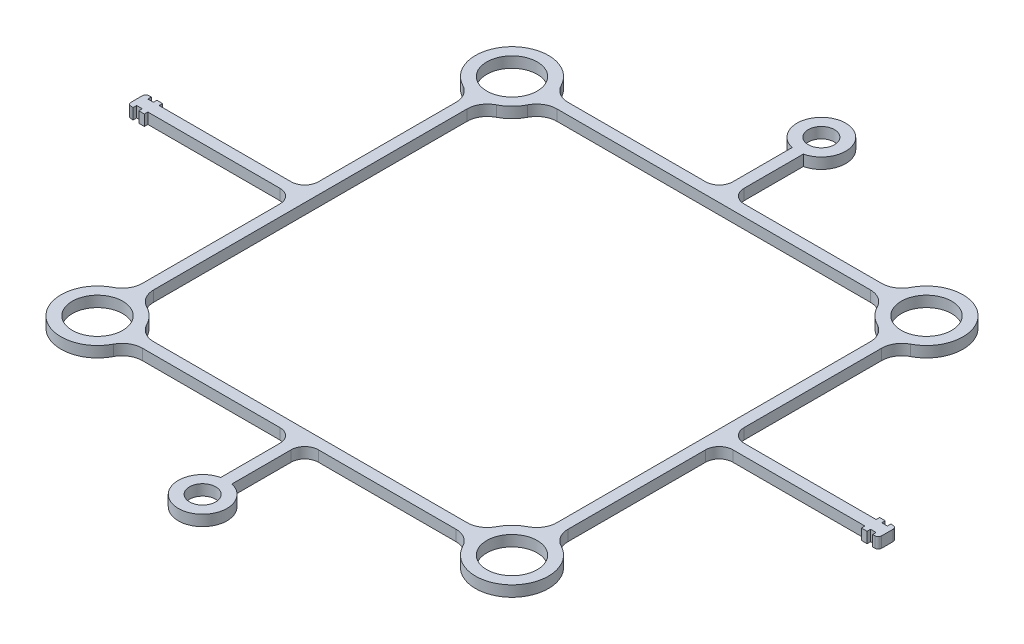
from build123d import *

# Parameters (mm, degrees)
SKETCH1_R           = 3.71
SKETCH1_R_2         = 1.925
BOSS_EXTRUDE1_DEPTH = 1.5875
FILLET1_R           = 3
FILLET2_R           = 2
FILLET3_R           = 0.5


with BuildPart() as part:
    # Sketch1 → Boss-Extrude1 (new body)
    with BuildSketch(Plane(origin=(0, 0, 0), x_dir=(1, 0, 0), z_dir=(0, 1, 0))):
        with BuildLine():
            Line((-25.148871697, 32.027846467), (-0.825, 32.027846467))
            Line((-0.825, 32.027846467), (-0.825, 42.724341041))
            ThreePointArc((-0.825, 42.724341041), (0, 49.777846467), (0.825, 42.724341041))
            Line((0.825, 42.724341041), (0.825, 32.027846467))
            Line((0.825, 32.027846467), (25.148871697, 32.027846467))
            ThreePointArc((25.148871697, 32.027846467), (34.235092347, 34.992938814), (31.27, 25.906718164))
            Line((31.27, 25.906718164), (31.27, 1.582846467))
            Line((31.27, 1.582846467), (52.669827862, 1.582846467))
            Line((52.669827862, 1.582846467), (52.669827862, 2.092846467))
            Line((52.669827862, 2.092846467), (53.494827862, 2.092846467))
            Line((53.494827862, 2.092846467), (53.494827862, 1.582846467))
            Line((53.494827862, 1.582846467), (54.319827862, 1.582846467))
            Line((54.319827862, 1.582846467), (54.319827862, 2.092846467))
            Line((54.319827862, 2.092846467), (55.144827862, 2.092846467))
            Line((55.144827862, 2.092846467), (55.144827862, -0.577153533))
            Line((55.144827862, -0.577153533), (54.319827862, -0.577153533))
            Line((54.319827862, -0.577153533), (54.319827862, -0.067153533))
            Line((54.319827862, -0.067153533), (53.494827862, -0.067153533))
            Line((53.494827862, -0.067153533), (53.494827862, -0.577153533))
            Line((53.494827862, -0.577153533), (52.669827862, -0.577153533))
            Line((52.669827862, -0.577153533), (52.669827862, -0.067153533))
            Line((52.669827862, -0.067153533), (31.27, -0.067153533))
            Line((31.27, -0.067153533), (31.27, -24.39102523))
            ThreePointArc((31.27, -24.39102523), (34.235092347, -33.47724588), (25.148871697, -30.512153533))
            Line((25.148871697, -30.512153533), (0.825, -30.512153533))
            Line((0.825, -30.512153533), (0.825, -41.208648107))
            ThreePointArc((0.825, -41.208648107), (0, -48.262153533), (-0.825, -41.208648107))
            Line((-0.825, -41.208648107), (-0.825, -30.512153533))
            Line((-0.825, -30.512153533), (-25.148871697, -30.512153533))
            ThreePointArc((-25.148871697, -30.512153533), (-34.235092347, -33.47724588), (-31.27, -24.39102523))
            Line((-31.27, -24.39102523), (-31.27, -0.067153533))
            Line((-31.27, -0.067153533), (-52.669827862, -0.067153533))
            Line((-52.669827862, -0.067153533), (-52.669827862, -0.577153533))
            Line((-52.669827862, -0.577153533), (-53.494827862, -0.577153533))
            Line((-53.494827862, -0.577153533), (-53.494827862, -0.067153533))
            Line((-53.494827862, -0.067153533), (-54.319827862, -0.067153533))
            Line((-54.319827862, -0.067153533), (-54.319827862, -0.577153533))
            Line((-54.319827862, -0.577153533), (-55.144827862, -0.577153533))
            Line((-55.144827862, -0.577153533), (-55.144827862, 2.092846467))
            Line((-55.144827862, 2.092846467), (-54.319827862, 2.092846467))
            Line((-54.319827862, 2.092846467), (-54.319827862, 1.582846467))
            Line((-54.319827862, 1.582846467), (-53.494827862, 1.582846467))
            Line((-53.494827862, 1.582846467), (-53.494827862, 2.092846467))
            Line((-53.494827862, 2.092846467), (-52.669827862, 2.092846467))
            Line((-52.669827862, 2.092846467), (-52.669827862, 1.582846467))
            Line((-52.669827862, 1.582846467), (-31.27, 1.582846467))
            Line((-31.27, 1.582846467), (-31.27, 25.906718164))
            ThreePointArc((-31.27, 25.906718164), (-34.235092347, 34.992938814), (-25.148871697, 32.027846467))
        make_face()
        with Locations(Location((-30.445, 31.202846467, 0), (0, 0, 270))):
            Circle(SKETCH1_R, mode=Mode.SUBTRACT)
        with Locations(Location((30.445, 31.202846467, 0), (0, 0, 90))):
            Circle(SKETCH1_R, mode=Mode.SUBTRACT)
        with Locations(Location((30.445, -29.687153533, 0), (0, 0, 270))):
            Circle(SKETCH1_R, mode=Mode.SUBTRACT)
        with Locations(Location((-30.445, -29.687153533, 0), (0, 0, 90))):
            Circle(SKETCH1_R, mode=Mode.SUBTRACT)
        with Locations(Location((0, 46.202846467, 0), (0, 0, 270))):
            Circle(SKETCH1_R_2, mode=Mode.SUBTRACT)
        with Locations(Location((0, -44.687153533, 0), (0, 0, 90))):
            Circle(SKETCH1_R_2, mode=Mode.SUBTRACT)
        with BuildLine():
            Line((-25.148871697, 30.377846467), (25.148871697, 30.377846467))
            ThreePointArc((25.148871697, 30.377846467), (26.654907653, 27.41275412), (29.62, 25.906718164))
            Line((29.62, 25.906718164), (29.62, -24.39102523))
            ThreePointArc((29.62, -24.39102523), (26.654907653, -25.897061186), (25.148871697, -28.862153533))
            Line((25.148871697, -28.862153533), (-25.148871697, -28.862153533))
            ThreePointArc((-25.148871697, -28.862153533), (-26.654907653, -25.897061186), (-29.62, -24.39102523))
            Line((-29.62, -24.39102523), (-29.62, 25.906718164))
            ThreePointArc((-29.62, 25.906718164), (-26.654907653, 27.41275412), (-25.148871697, 30.377846467))
        make_face(mode=Mode.SUBTRACT)
    extrude(amount=BOSS_EXTRUDE1_DEPTH)

    # Fillet1
    fillet1_edges = [part.edges().sort_by_distance(p)[0] for p in [
        (-25.148871697, 0.79375, -30.377846467),
        (-29.62, 0.79375, -25.906718164),
        (-29.62, 0.79375, 24.39102523),
        (-25.148871697, 0.79375, 28.862153533),
        (25.148871697, 0.79375, 28.862153533),
        (29.62, 0.79375, 24.39102523),
        (29.62, 0.79375, -25.906718164),
        (25.148871697, 0.79375, -30.377846467),
        (31.27, 0.79375, 24.39102523),
        (25.148871697, 0.79375, 30.512153533),
        (-25.148871697, 0.79375, 30.512153533),
        (-31.27, 0.79375, 24.39102523),
        (-31.27, 0.79375, -25.906718164),
        (-25.148871697, 0.79375, -32.027846467),
        (25.148871697, 0.79375, -32.027846467),
        (31.27, 0.79375, -25.906718164),
    ]]
    fillet(fillet1_edges, radius=FILLET1_R)

    # Fillet2
    fillet2_edges = [part.edges().sort_by_distance(p)[0] for p in [
        (31.27, 0.79375, 0.067153533),
        (0.825, 0.79375, 30.512153533),
        (-0.825, 0.79375, 30.512153533),
        (-31.27, 0.79375, 0.067153533),
        (-31.27, 0.79375, -1.582846467),
        (-0.825, 0.79375, -32.027846467),
        (0.825, 0.79375, -32.027846467),
        (31.27, 0.79375, -1.582846467),
    ]]
    fillet(fillet2_edges, radius=FILLET2_R)

    # Fillet3
    fillet3_edges = [part.edges().sort_by_distance(p)[0] for p in [
        (55.144827862, 0.79375, -2.092846467),
        (55.144827862, 0.79375, 0.577153533),
        (-55.144827862, 0.79375, 0.577153533),
        (-55.144827862, 0.79375, -2.092846467),
    ]]
    fillet(fillet3_edges, radius=FILLET3_R)


solid = part.part
